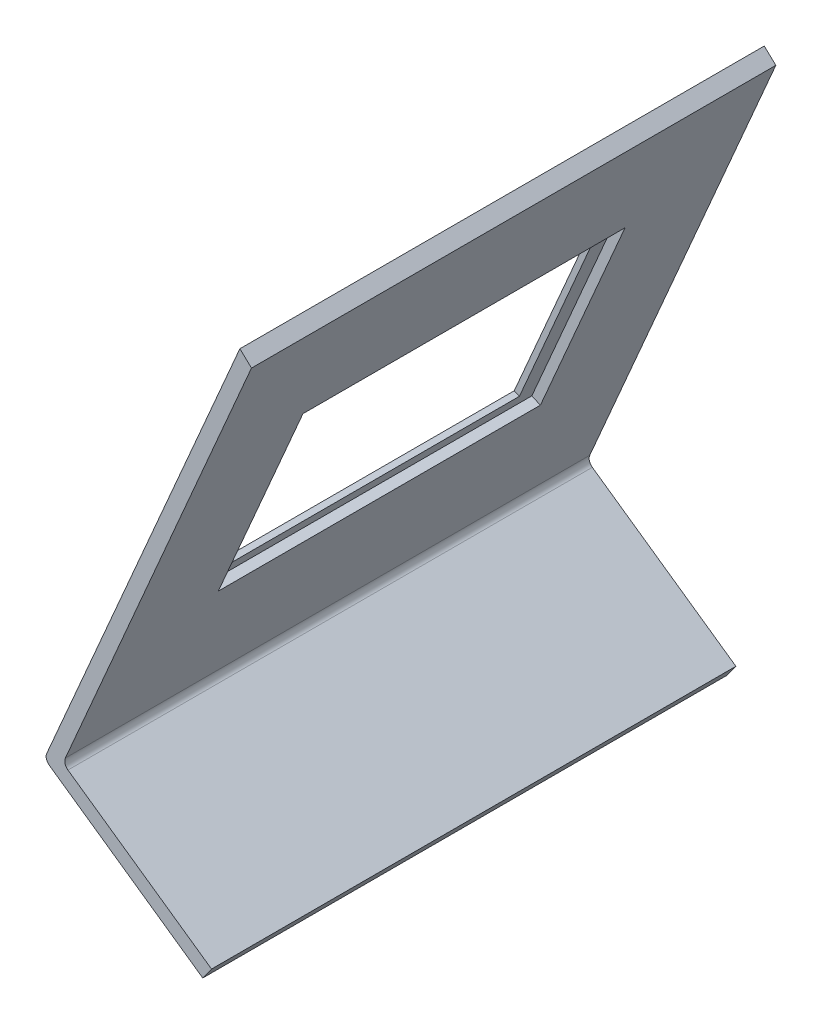
from build123d import *

# Parameters (mm, degrees)
RESSALTO_EXTRUS_O1_DEPTH = 140
ESBO_O3_W                = 86
ESBO_O3_H                = 57
ESBO_O3_W_2              = 77
ESBO_O3_H_2              = 51
CORTE_EXTRUS_O1_DEPTH    = 2.5
ESBO_O4_W                = 77
ESBO_O4_H                = 51
CORTE_EXTRUS_O2_DEPTH    = 201.480317617
CORTE_EXTRUS_O3_DEPTH    = 210.721949933


with BuildPart() as part:
    # Esboço1 → Ressalto-extrusão1 (new body)
    with BuildSketch(Plane.XY):
        with BuildLine():
            Line((-41.646443714, 31.110299699), (9.909852794, 150.449933896))
            Line((9.909852794, 150.449933896), (13.581841538, 148.863586311))
            Line((13.581841538, 148.863586311), (-36.681468487, 32.516884972))
            ThreePointArc((-36.681468487, 32.516884972), (-36.769743597, 31.178562616), (-35.992626987, 30.085407091))
            Line((-35.992626987, 30.085407091), (2.342768013, 3.242674532))
            Line((2.342768013, 3.242674532), (0, 0))
            Line((0, 0), (-40.957602214, 28.678821818))
            ThreePointArc((-40.957602214, 28.678821818), (-41.734718825, 29.771977342), (-41.646443714, 31.110299699))
        make_face()
    extrude(amount=-RESSALTO_EXTRUS_O1_DEPTH)

    # Esboço3 → Corte-extrusão1 (cut)
    with BuildSketch(Plane(origin=(-42.750445362, 18.468756434, 0), x_dir=(0, 0, -1), z_dir=(0.9179971861354039, -0.39658689621252097, 0))):
        with Locations((70, 78.672876452)):
            Rectangle(ESBO_O3_W, ESBO_O3_H)
        with Locations((70, 78.672876452)):
            Rectangle(ESBO_O3_W_2, ESBO_O3_H_2, mode=Mode.SUBTRACT)
    extrude(amount=-CORTE_EXTRUS_O1_DEPTH, mode=Mode.SUBTRACT)

    # Esboço4 → Corte-extrusão2 (cut, through all)
    with BuildSketch(Plane(origin=(-42.750445362, 18.468756434, 0), x_dir=(0, 0, -1), z_dir=(0.9179971861354039, -0.39658689621252097, 0))):
        with Locations((70, 78.672876452)):
            Rectangle(ESBO_O4_W, ESBO_O4_H)
    extrude(amount=-CORTE_EXTRUS_O2_DEPTH, mode=Mode.SUBTRACT)

    # Esboço5 → Corte-extrusão3 (cut, through all)
    with BuildSketch(Plane.XY):
        Polygon((9.909852794, 150.449933896), (13.004458236, 147.527091708), (13.581841538, 148.863586311), align=None)
    extrude(amount=-CORTE_EXTRUS_O3_DEPTH, mode=Mode.SUBTRACT)


solid = part.part
